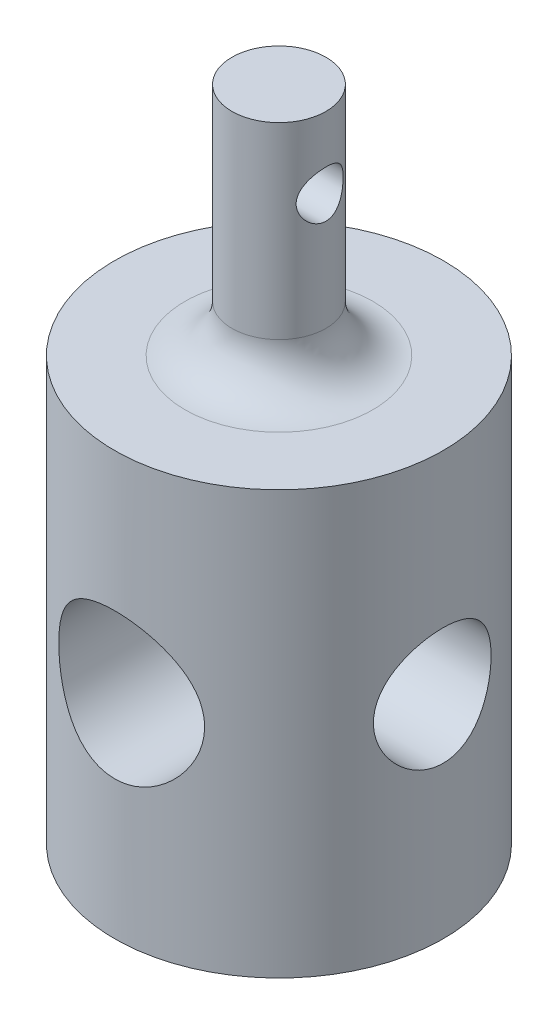
from build123d import *

# Parameters (mm, degrees)
SKETCH1_R                 = 1
BOSS_EXTRUDE1_DEPTH       = 5
SKETCH2_R                 = 3.5
BOSS_EXTRUDE2_DEPTH       = 9
F_3_0MM_DOWEL_HOLE1_D     = 3.1
F_3_0MM_DOWEL_HOLE2_D     = 2.5
F_3_0MM_DOWEL_HOLE2_DEPTH = 3
F_3_0MM_DOWEL_HOLE2_TIP   = 0.751075774
F_1_0MM_DOWEL_HOLE1_D     = 1
FILLET1_R                 = 1


with BuildPart() as part:
    # Sketch1 → Boss-Extrude1 (new body)
    with BuildSketch(Plane(origin=(0, 0, 0), x_dir=(1, 0, 0), z_dir=(0, 1, 0))):
        with Locations(Location((0, 0, 0), (0, 0, 270))):
            Circle(SKETCH1_R)
    extrude(amount=BOSS_EXTRUDE1_DEPTH)

    # Sketch2 → Boss-Extrude2 (add)
    with BuildSketch(Plane.XZ):
        with Locations(Location((0, 0, 0), (0, 0, 270))):
            Circle(SKETCH2_R)
    extrude(amount=BOSS_EXTRUDE2_DEPTH)

    # Ø3.0mm Dowel Hole1 (through all)
    with Locations(Plane(origin=(0.004438696, -4.500949112, 3.499997185), x_dir=(0.999999195836, 0, -0.001268198744), z_dir=(0.001268198744, 0, 0.999999195836))):
        with Locations((0, 0)):
            Hole(F_3_0MM_DOWEL_HOLE1_D / 2)

    # Ø3.0mm Dowel Hole2
    with Locations(Plane(origin=(3.499992934, -4.513990385, 0.007032841), x_dir=(-0.002009383102, 0, 0.999997981188), z_dir=(0.999997981188, 0, 0.002009383102))):
        with Locations((0, 0)):
            Hole(F_3_0MM_DOWEL_HOLE2_D / 2, depth=F_3_0MM_DOWEL_HOLE2_DEPTH)
            with Locations((0, 0, -(F_3_0MM_DOWEL_HOLE2_DEPTH + F_3_0MM_DOWEL_HOLE2_TIP / 2))):  # 118° drill point
                Cone(0, F_3_0MM_DOWEL_HOLE2_D / 2, F_3_0MM_DOWEL_HOLE2_TIP, mode=Mode.SUBTRACT)

    # Ø1.0mm Dowel Hole1 (through all)
    with Locations(Plane(origin=(1, 3.476098955, 0), x_dir=(0, 0, 1), z_dir=(1, 0, 0))):
        with Locations((0, 0)):
            Hole(F_1_0MM_DOWEL_HOLE1_D / 2)

    # Fillet1
    fillet1_edges = [part.edges().sort_by_distance(p)[0] for p in [
        (0, 0, -1),
    ]]
    fillet(fillet1_edges, radius=FILLET1_R)


solid = part.part
